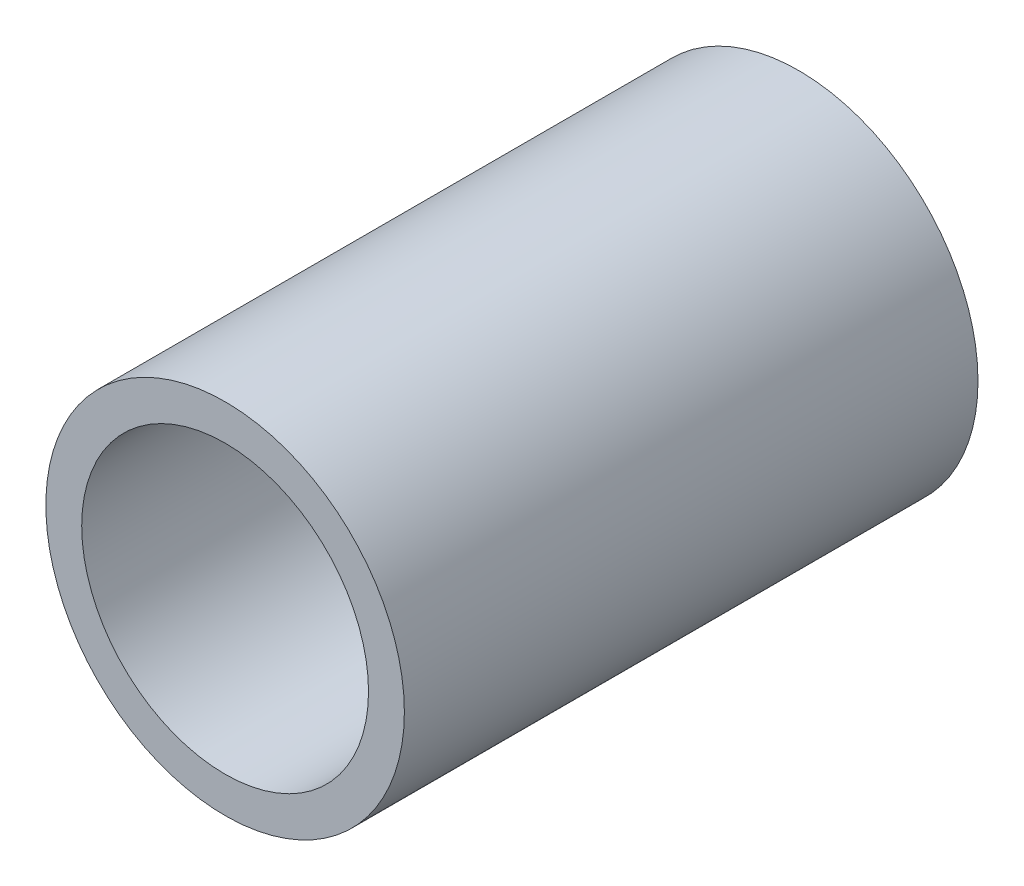
from build123d import *

# Parameters (mm, degrees)
SKETCH_1_R      = 12.5
SKETCH_1_R_2    = 10
EXTRUDE_3_DEPTH = 40


with BuildPart() as part:
    # 스케치1 → 보스-돌출3 (new body)
    with BuildSketch(Plane.XY):
        Circle(SKETCH_1_R)
        Circle(SKETCH_1_R_2, mode=Mode.SUBTRACT)
    extrude(amount=EXTRUDE_3_DEPTH)


solid = part.part
